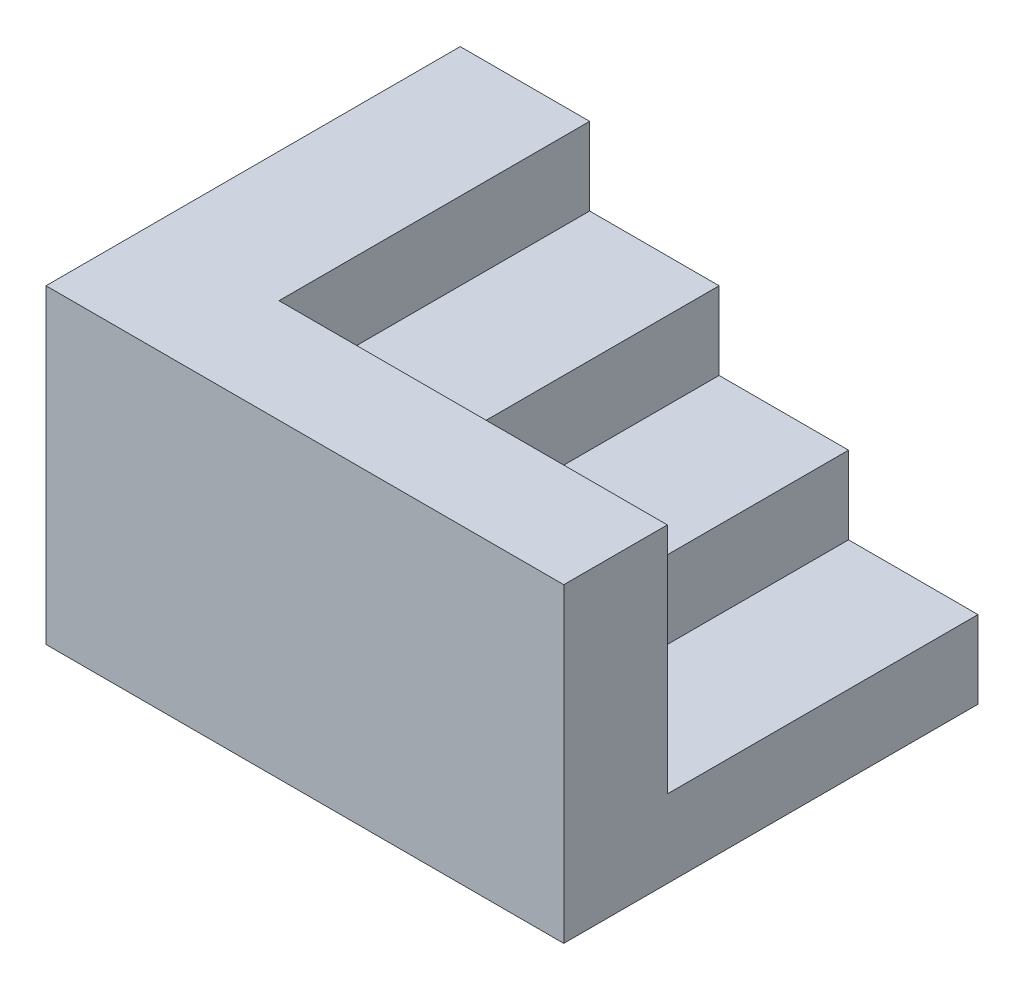
from build123d import *

# Parameters (mm, degrees)
SKETCH1_W               = 100
SKETCH1_H               = 60
BOSS_EXTRUDE1_DEPTH     = 80
CUT_EXTRUDE1_DEPTH      = 99.994949366
CUT_EXTRUDE1_DEPTH_BACK = 60


with BuildPart() as part:
    # Sketch1 → Boss-Extrude1 (new body)
    with BuildSketch(Plane.XY):
        Rectangle(SKETCH1_W, SKETCH1_H)
    extrude(amount=BOSS_EXTRUDE1_DEPTH)

    # Sketch2 → Cut-Extrude1 (cut, two sides: drawn at the far end of the back side and taken through both)
    with BuildSketch(Plane(origin=(0, 0, 0), x_dir=(-1, 0, 0), z_dir=(0, 0, -1)).offset(-CUT_EXTRUDE1_DEPTH_BACK)):
        Polygon((-50, -273.238075794), (-50, -30), (-50, -15), (-25, -15), (-25, 0), (0, 0), (0, 15), (25, 15), (25, 30), (50, 30), (293.238075794, 30), (-28.852517656, 394.577420687), (-372.09059345, 91.339344893), align=None)
    extrude(amount=CUT_EXTRUDE1_DEPTH + CUT_EXTRUDE1_DEPTH_BACK, mode=Mode.SUBTRACT)


solid = part.part
